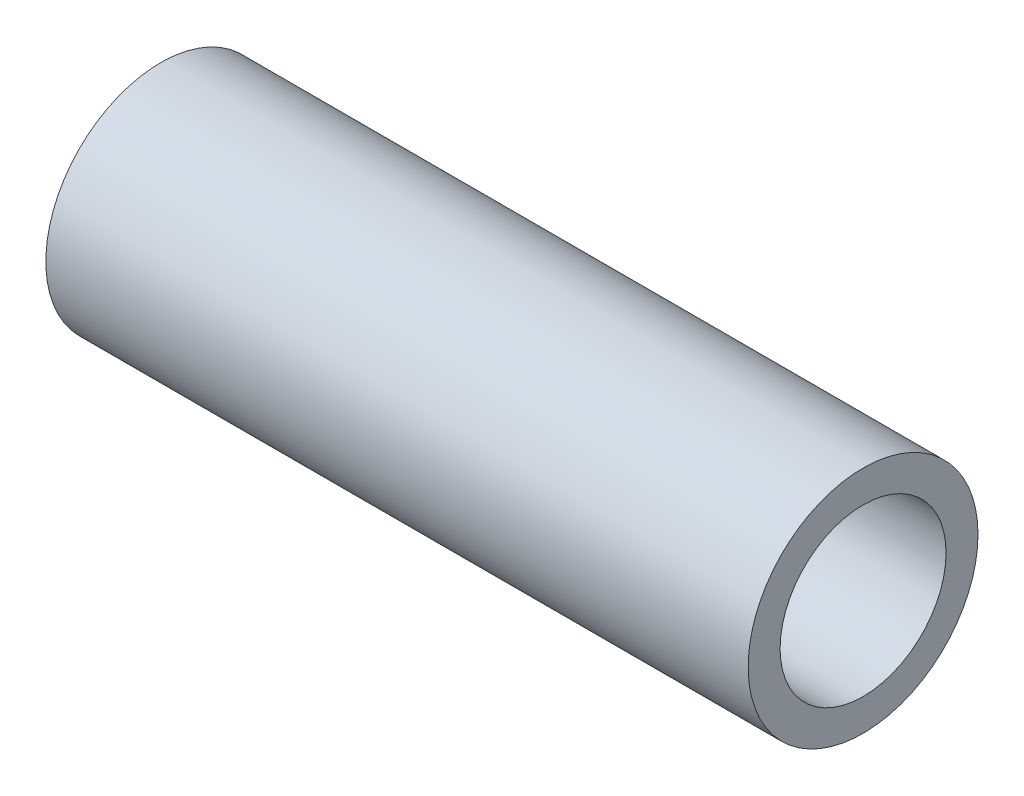
from build123d import *

# Parameters (mm, degrees)
SKETCH2_R           = 9
SKETCH2_R_2         = 6.5
BOSS_EXTRUDE1_DEPTH = 27.5


with BuildPart() as part:
    # Sketch2 → Boss-Extrude1 (new, symmetric)
    with BuildSketch(Plane(origin=(0, 0, 0), x_dir=(0, 0, -1), z_dir=(1, 0, 0))):
        Circle(SKETCH2_R)
        Circle(SKETCH2_R_2, mode=Mode.SUBTRACT)
    extrude(amount=BOSS_EXTRUDE1_DEPTH, both=True)


solid = part.part
